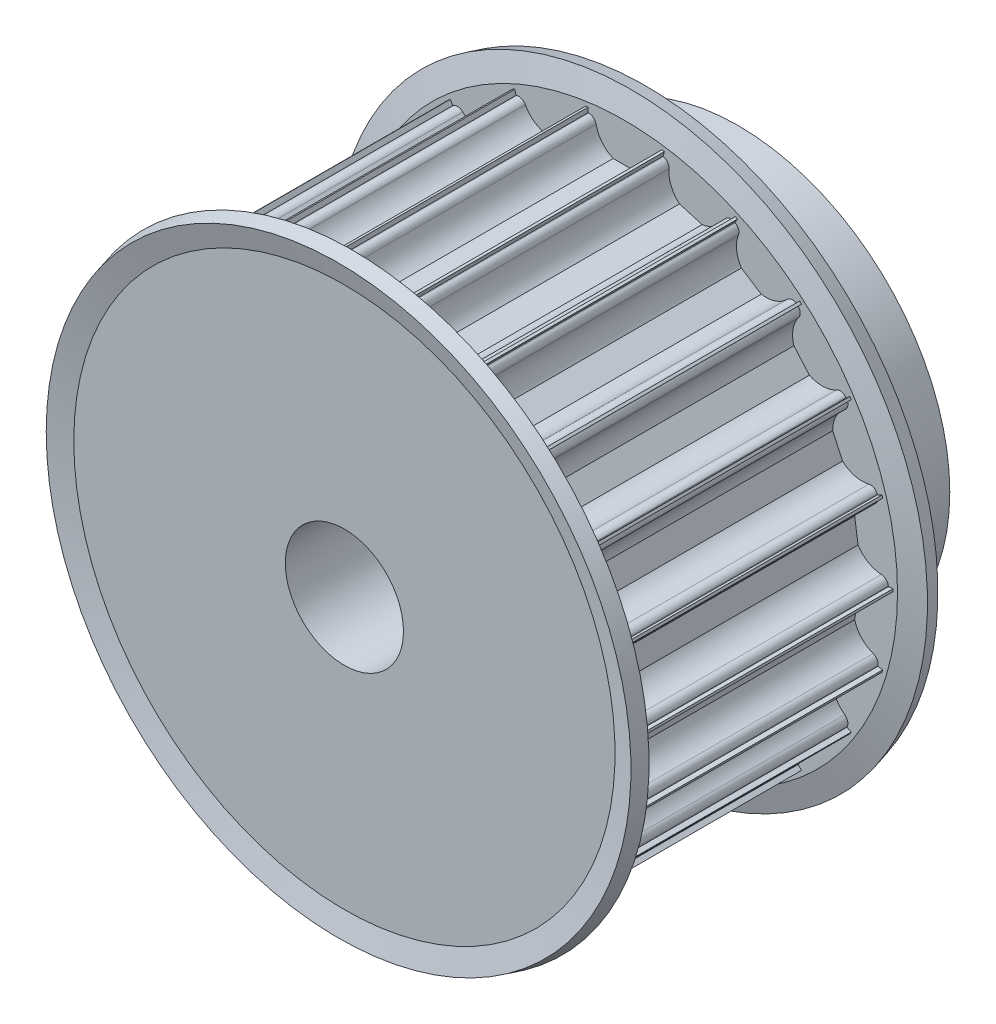
from build123d import *

# Parameters (mm, degrees)
CUT_EXTRUDE1_REACH = 57.544
CIRPATTERN1_COUNT  = 22


with BuildPart() as part:
    # Sketch1 → Revolve1 (revolve)
    with BuildSketch(Plane(origin=(0, 0, 0), x_dir=(0, 0, -1), z_dir=(1, 0, 0)), mode=Mode.PRIVATE) as revolve1_sk:
        Polygon((0, 6), (40, 6), (40, 21.5), (30, 21.5), (30, 27.25), (0, 27.25), align=None)
    revolve(revolve1_sk.sketch.rotate(Axis((0, 0, 0), (0, 0, -1)), 90), axis=Axis((0, 0, 0), (0, 0, -1)))

    # Sketch2 → Cut-Extrude1 (cut, up to next)
    with BuildSketch(Plane.XY, mode=Mode.PRIVATE) as cut_extrude1_sk1:
        with BuildLine():
            Line((-3.674234614, 26.5), (-3.75, 26.5))
            Line((-3.75, 26.5), (-3.75, 28.5))
            Line((-3.75, 28.5), (3.75, 28.5))
            Line((3.75, 28.5), (3.75, 26.5))
            Line((3.75, 26.5), (3.674234614, 26.5))
            ThreePointArc((3.674234614, 26.5), (3.199892965, 26.330947502), (2.939387691, 25.9))
            ThreePointArc((2.939387691, 25.9), (2.331759211, 24.612435701), (1.198957881, 23.75))
            Line((1.198957881, 23.75), (-1.198957881, 23.75))
            ThreePointArc((-1.198957881, 23.75), (-2.331759211, 24.612435701), (-2.939387691, 25.9))
            ThreePointArc((-2.939387691, 25.9), (-3.199892965, 26.330947502), (-3.674234614, 26.5))
        make_face()
    cut_extrude1_tool1 = extrude(cut_extrude1_sk1.sketch, amount=-CUT_EXTRUDE1_REACH, mode=Mode.PRIVATE) & part.part
    cut_extrude1 = cut_extrude1_tool1.solids().sort_by_distance((0, 26.435169, 0))[0]
    add(cut_extrude1, mode=Mode.SUBTRACT)

    # CirPattern1: Cut-Extrude1 ×22 about axis
    cirpattern1_axis = Axis((0, 0, 0), (0, 0, 1))
    for i in range(1, CIRPATTERN1_COUNT):
        add(cut_extrude1.rotate(cirpattern1_axis, i * 360 / CIRPATTERN1_COUNT), mode=Mode.SUBTRACT)

    # Sketch3 → Revolve2 (revolve)
    with BuildSketch(Plane(origin=(0, 0, 0), x_dir=(0, 0, -1), z_dir=(1, 0, 0)), mode=Mode.PRIVATE) as revolve2_sk:
        Polygon((30, 21.5), (30, 27.492521254), (30.591966801, 29.701771432), (29.143078062, 30.09), (28.5, 27.69), (28.5, 21.5), align=None)
        Polygon((1.5, 21.5), (0, 21.5), (0, 27.492521254), (-0.591966801, 29.701771432), (0.856921938, 30.09), (1.5, 27.69), align=None)
    revolve(revolve2_sk.sketch.rotate(Axis((0, 0, -28.994300906), (0, 0, 1)), 90), axis=Axis((0, 0, -28.994300906), (0, 0, 1)))


solid = part.part
